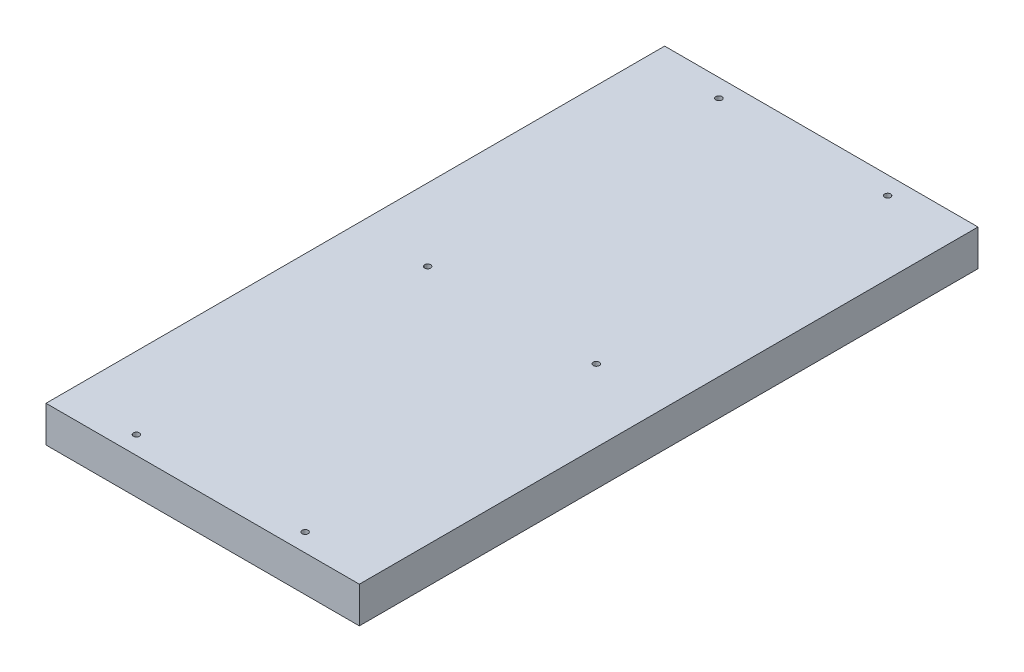
from build123d import *

# Parameters (mm, degrees)
ESQUISSE1_W             = 390
ESQUISSE1_H             = 45
BOSS_EXTRU_1_DEPTH      = 770
ESQUISSE2_R             = 3.75
ENL_V_MAT_EXTRU_1_DEPTH = 20
ESQUISSE3_R             = 3.75
ENL_V_MAT_EXTRU_2_DEPTH = 30


with BuildPart() as part:
    # Esquisse1 → Boss.-Extru.1 (new body)
    with BuildSketch(Plane.XY):
        Rectangle(ESQUISSE1_W, ESQUISSE1_H)
    extrude(amount=BOSS_EXTRU_1_DEPTH)

    # Esquisse2 → Enlèv. mat.-Extru.1 (cut)
    with BuildSketch(Plane(origin=(0, 22.5, 0), x_dir=(1, 0, 0), z_dir=(0, 1, 0))):
        with Locations(Location((-105, -22.5, 0), (0, 0, 270))):
            Circle(ESQUISSE2_R)
        with Locations(Location((105, -22.5, 0), (0, 0, 90))):
            Circle(ESQUISSE2_R)
        with Locations(Location((105, -747.5, 0), (0, 0, 270))):
            Circle(ESQUISSE2_R)
        with Locations(Location((-105, -747.5, 0), (0, 0, 90))):
            Circle(ESQUISSE2_R)
        with Locations(Location((-105, -385, 0), (0, 0, 270))):
            Circle(ESQUISSE2_R)
        with Locations(Location((105, -385, 0), (0, 0, 270))):
            Circle(ESQUISSE2_R)
    extrude(amount=-ENL_V_MAT_EXTRU_1_DEPTH, mode=Mode.SUBTRACT)

    # Esquisse3 → Enlèv. mat.-Extru.2 (cut)
    with BuildSketch(Plane(origin=(0, 22.5, 0), x_dir=(1, 0, 0), z_dir=(0, 1, 0))):
        with Locations(Location((-105, -385, 0), (0, 0, 270))):
            Circle(ESQUISSE3_R)
        with Locations(Location((105, -385, 0), (0, 0, 270))):
            Circle(ESQUISSE3_R)
    extrude(amount=-ENL_V_MAT_EXTRU_2_DEPTH, mode=Mode.SUBTRACT)


solid = part.part
